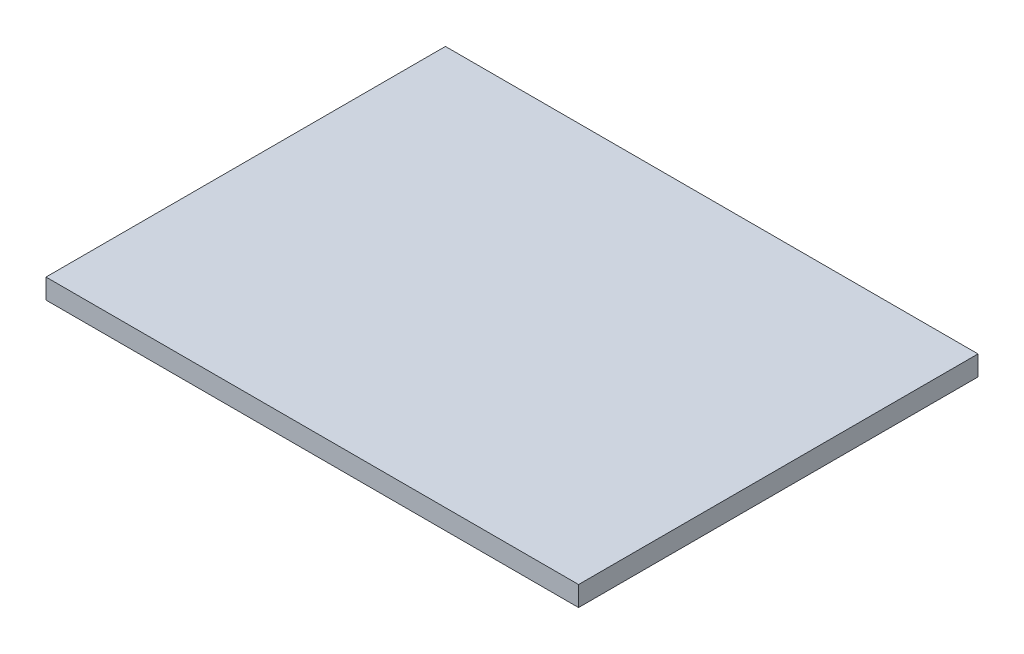
from build123d import *

# Parameters (mm, degrees)
SKETCH_1_W      = 80
SKETCH_1_H      = 60
EXTRUDE_1_DEPTH = 3


with BuildPart() as part:
    # 草图1 → 凸台-拉伸1 (new body)
    with BuildSketch(Plane(origin=(0, 0, 0), x_dir=(1, 0, 0), z_dir=(0, 1, 0))):
        Rectangle(SKETCH_1_W, SKETCH_1_H)
    extrude(amount=EXTRUDE_1_DEPTH)


solid = part.part
